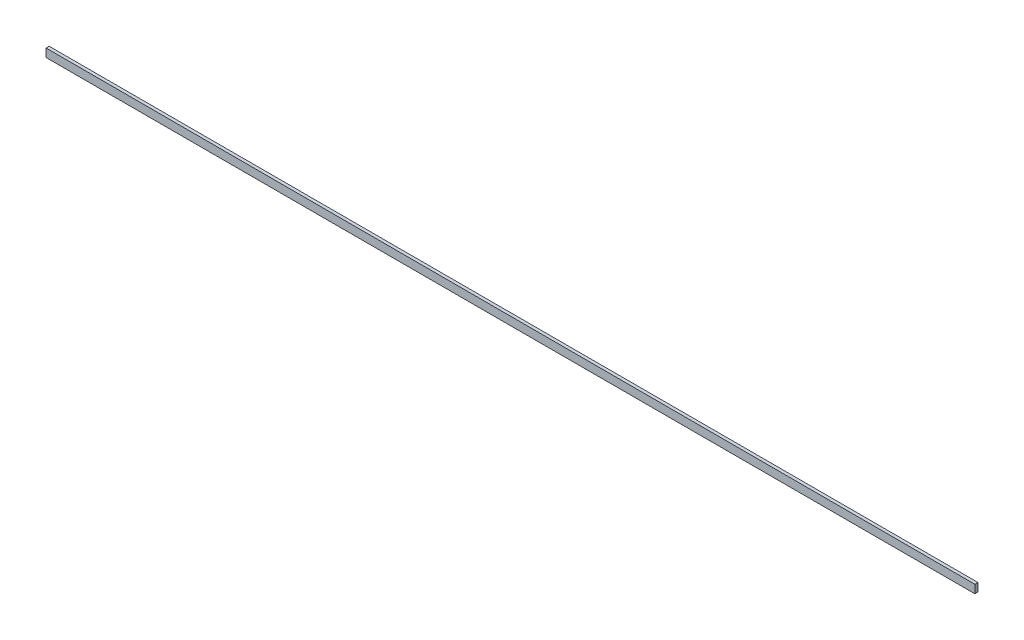
from build123d import *

# Parameters (mm, degrees)
SKETCH2_W           = 900
SKETCH2_H           = 8
BOSS_EXTRUDE1_DEPTH = 1.5


with BuildPart() as part:
    # Sketch2 → Boss-Extrude1 (new, symmetric)
    with BuildSketch(Plane.XY):
        Rectangle(SKETCH2_W, SKETCH2_H)
    extrude(amount=BOSS_EXTRUDE1_DEPTH, both=True)


solid = part.part
